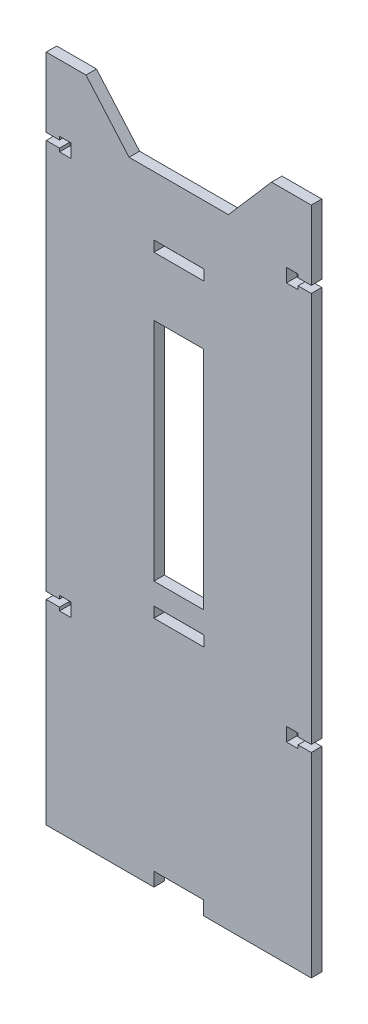
from build123d import *

# Parameters (mm, degrees)
SKETCH1_W                = 80
SKETCH1_H                = 385
BOSS_EXTRUDE1_DEPTH      = 3.175
CUT_EXTRUDE1_DEPTH       = 3.175
LPATTERN1_COUNT          = 2
LPATTERN1_PITCH          = 60
LPATTERN2_COUNT          = 2
LPATTERN2_PITCH          = 120
LPATTERN3_COUNT          = 2
LPATTERN3_PITCH          = 195
LPATTERN6_COUNT          = 2
LPATTERN6_PITCH          = 315
MIRROR2_COPY_1_DEPTH     = 3.175
MIRROR2_COPY_2_DEPTH     = 3.175
MIRROR2_COPY_3_DEPTH     = 3.175
MIRROR2_COPY_4_DEPTH     = 3.175
SKETCH7_W                = 15
SKETCH7_H                = 4.175
CUT_EXTRUDE2_DEPTH       = 10
SKETCH8_W                = 15
SKETCH8_H                = 3.175
CUT_EXTRUDE3_DEPTH       = 10
SKETCH9_W                = 15.1
SKETCH9_H                = 3.2
CUT_EXTRUDE4_DEPTH       = 349.618818518
SKETCH11_R               = 1.55
CUT_EXTRUDE6_DEPTH       = 349.618818518
CUT_EXTRUDE7_DEPTH       = 10
LPATTERN4_COUNT          = 3
LPATTERN4_PITCH          = 7
MIRROR4_COPY_1_DEPTH     = 10
MIRROR4_COPY_2_DEPTH     = 10
SKETCH14_R               = 1.55
CUT_EXTRUDE9_DEPTH       = 349.618818518
LPATTERN5_COUNT          = 2
LPATTERN5_PITCH          = 135
LPATTERN5_COPY_1_DEPTH   = 10
LPATTERN5_COPY_2_DEPTH   = 10
LPATTERN5_COPY_3_DEPTH   = 10
LPATTERN5_COPY_4_DEPTH   = 10
LPATTERN5_COPY_5_DEPTH   = 10
CUT_EXTRUDE10_DEPTH      = 349.618818518
LPATTERN7_COUNT          = 2
LPATTERN7_PITCH          = 60
CUT_EXTRUDE11_DEPTH      = 349.618818518
CUT_EXTRUDE11_DEPTH_BACK = 349.618818518
SKETCH17_W               = 15
SKETCH17_H               = 70
SKETCH18_W               = 15
SKETCH18_H               = 5
BOSS_EXTRUDE3_DEPTH      = 3.175
SKETCH19_W               = 15.1
SKETCH19_H               = 3.2
CUT_EXTRUDE12_DEPTH      = 349.618818518
CUT_EXTRUDE13_DEPTH      = 349.618818518
CUT_EXTRUDE13_DEPTH_BACK = 349.618818518
SKETCH20_W               = 119.305131634
SKETCH20_H               = 211.592052797
BOSS_EXTRUDE4_DEPTH      = 3.175
CUT_EXTRUDE15_DEPTH      = 0.5


with BuildPart() as part:
    # Sketch1 → Boss-Extrude1 (new body)
    with BuildSketch(Plane.XY):
        with Locations((-10, 152.5)):
            Rectangle(SKETCH1_W, SKETCH1_H)
    extrude(amount=-BOSS_EXTRUDE1_DEPTH)

    # Sketch6 → Cut-Extrude1 (cut)
    with BuildSketch(Plane.XY):
        Polygon((-50, 336.05), (-46, 336.05), (-46, 337.05), (-42.5, 337.05), (-42.5, 332.95), (-46, 332.95), (-46, 333.95), (-50, 333.95), align=None)
    cut_extrude1 = extrude(amount=-CUT_EXTRUDE1_DEPTH, mode=Mode.SUBTRACT)

    # LPattern1: Cut-Extrude1 ×2
    with Locations(*[(0, -i * LPATTERN1_PITCH, 0) for i in range(1, LPATTERN1_COUNT)]):
        add(cut_extrude1, mode=Mode.SUBTRACT)

    # LPattern2: Cut-Extrude1 ×2
    with Locations(*[(0, -i * LPATTERN2_PITCH, 0) for i in range(1, LPATTERN2_COUNT)]):
        add(cut_extrude1, mode=Mode.SUBTRACT)

    # LPattern3: Cut-Extrude1 ×2
    with Locations(*[(0, -i * LPATTERN3_PITCH, 0) for i in range(1, LPATTERN3_COUNT)]):
        add(cut_extrude1, mode=Mode.SUBTRACT)

    # LPattern6: Cut-Extrude1 ×2
    with Locations(*[(0, -i * LPATTERN6_PITCH, 0) for i in range(1, LPATTERN6_COUNT)]):
        add(cut_extrude1, mode=Mode.SUBTRACT)

    # Mirror2: Cut-Extrude1 across plane
    add(cut_extrude1.mirror(Plane.ZY.offset(10)), mode=Mode.SUBTRACT)

    # Mirror2 copy 1 sketch → Mirror2 copy 1 (cut)
    with BuildSketch(Plane(origin=(-20, -60, 0), x_dir=(-1, 0, 0), z_dir=(0, 0, 1))):
        Polygon((-50, -336.05), (-46, -336.05), (-46, -337.05), (-42.5, -337.05), (-42.5, -332.95), (-46, -332.95), (-46, -333.95), (-50, -333.95), align=None)
    extrude(amount=-MIRROR2_COPY_1_DEPTH, mode=Mode.SUBTRACT)

    # Mirror2 copy 2 sketch → Mirror2 copy 2 (cut)
    with BuildSketch(Plane(origin=(-20, -120, 0), x_dir=(-1, 0, 0), z_dir=(0, 0, 1))):
        Polygon((-50, -336.05), (-46, -336.05), (-46, -337.05), (-42.5, -337.05), (-42.5, -332.95), (-46, -332.95), (-46, -333.95), (-50, -333.95), align=None)
    extrude(amount=-MIRROR2_COPY_2_DEPTH, mode=Mode.SUBTRACT)

    # Mirror2 copy 3 sketch → Mirror2 copy 3 (cut)
    with BuildSketch(Plane(origin=(-20, -195, 0), x_dir=(-1, 0, 0), z_dir=(0, 0, 1))):
        Polygon((-50, -336.05), (-46, -336.05), (-46, -337.05), (-42.5, -337.05), (-42.5, -332.95), (-46, -332.95), (-46, -333.95), (-50, -333.95), align=None)
    extrude(amount=-MIRROR2_COPY_3_DEPTH, mode=Mode.SUBTRACT)

    # Mirror2 copy 4 sketch → Mirror2 copy 4 (cut)
    with BuildSketch(Plane(origin=(-20, -315, 0), x_dir=(-1, 0, 0), z_dir=(0, 0, 1))):
        Polygon((-50, -336.05), (-46, -336.05), (-46, -337.05), (-42.5, -337.05), (-42.5, -332.95), (-46, -332.95), (-46, -333.95), (-50, -333.95), align=None)
    extrude(amount=-MIRROR2_COPY_4_DEPTH, mode=Mode.SUBTRACT)

    # Sketch7 → Cut-Extrude2 (cut)
    with BuildSketch(Plane.XY):
        with Locations((-10, 342.9125)):
            Rectangle(SKETCH7_W, SKETCH7_H)
        with Locations((-10, -37.9125)):
            Rectangle(SKETCH7_W, SKETCH7_H)
    extrude(amount=-CUT_EXTRUDE2_DEPTH, mode=Mode.SUBTRACT)

    # Sketch8 → Cut-Extrude3 (cut)
    with BuildSketch(Plane.XY):
        with Locations((-10, 36.5875)):
            Rectangle(SKETCH8_W, SKETCH8_H)
    extrude(amount=-CUT_EXTRUDE3_DEPTH, mode=Mode.SUBTRACT)

    # Sketch9 → Cut-Extrude4 (cut, through all)
    with BuildSketch(Plane.XY):
        with Locations((-9.95, 127.575)):
            Rectangle(SKETCH9_W, SKETCH9_H)
    cut_extrude4 = extrude(amount=-CUT_EXTRUDE4_DEPTH, mode=Mode.SUBTRACT)

    # Sketch11 → Cut-Extrude6 (cut, through all)
    with BuildSketch(Plane.XY):
        with Locations((-34, 325.825)):
            Circle(SKETCH11_R)
        with Locations((-34, 267.825)):
            Circle(SKETCH11_R)
        with Locations((14, 325.825)):
            Circle(SKETCH11_R)
        with Locations((14, 267.825)):
            Circle(SKETCH11_R)
    extrude(amount=-CUT_EXTRUDE6_DEPTH, mode=Mode.SUBTRACT)

    # Sketch12 → Cut-Extrude7 (cut)
    with BuildSketch(Plane.XY):
        with BuildLine():
            Line((-2, 286.825), (-2, 314.825))
            ThreePointArc((-2, 314.825), (0, 316.825), (2, 314.825))
            Line((2, 314.825), (2, 286.825))
            ThreePointArc((2, 286.825), (0, 284.825), (-2, 286.825))
        make_face()
    cut_extrude7 = extrude(amount=-CUT_EXTRUDE7_DEPTH, mode=Mode.SUBTRACT)

    # LPattern4: Cut-Extrude7 ×3
    with Locations(*[(i * LPATTERN4_PITCH, 0, 0) for i in range(1, LPATTERN4_COUNT)]):
        add(cut_extrude7, mode=Mode.SUBTRACT)

    # Mirror4: Cut-Extrude7 across plane
    add(cut_extrude7.mirror(Plane.ZY.offset(10)), mode=Mode.SUBTRACT)

    # Mirror4 copy 1 sketch → Mirror4 copy 1 (cut)
    with BuildSketch(Plane(origin=(-27, 0, 0), x_dir=(-1, 0, 0), z_dir=(0, 0, 1))):
        with BuildLine():
            Line((-2, -286.825), (-2, -314.825))
            ThreePointArc((-2, -314.825), (0, -316.825), (2, -314.825))
            Line((2, -314.825), (2, -286.825))
            ThreePointArc((2, -286.825), (0, -284.825), (-2, -286.825))
        make_face()
    extrude(amount=-MIRROR4_COPY_1_DEPTH, mode=Mode.SUBTRACT)

    # Mirror4 copy 2 sketch → Mirror4 copy 2 (cut)
    with BuildSketch(Plane(origin=(-34, 0, 0), x_dir=(-1, 0, 0), z_dir=(0, 0, 1))):
        with BuildLine():
            Line((-2, -286.825), (-2, -314.825))
            ThreePointArc((-2, -314.825), (0, -316.825), (2, -314.825))
            Line((2, -314.825), (2, -286.825))
            ThreePointArc((2, -286.825), (0, -284.825), (-2, -286.825))
        make_face()
    extrude(amount=-MIRROR4_COPY_2_DEPTH, mode=Mode.SUBTRACT)

    # Sketch14 → Cut-Extrude9 (cut, through all)
    with BuildSketch(Plane.XY):
        with Locations((-10, 327.825)):
            Circle(SKETCH14_R)
    extrude(amount=-CUT_EXTRUDE9_DEPTH, mode=Mode.SUBTRACT)

    # LPattern5: Cut-Extrude7 ×2
    with Locations(*[(0, -i * LPATTERN5_PITCH, 0) for i in range(1, LPATTERN5_COUNT)]):
        add(cut_extrude7, mode=Mode.SUBTRACT)

    # LPattern5 copy 1 sketch → LPattern5 copy 1 (cut)
    with BuildSketch(Plane(origin=(7, -135, 0), x_dir=(1, 0, 0), z_dir=(0, 0, 1))):
        with BuildLine():
            Line((-2, 286.825), (-2, 314.825))
            ThreePointArc((-2, 314.825), (0, 316.825), (2, 314.825))
            Line((2, 314.825), (2, 286.825))
            ThreePointArc((2, 286.825), (0, 284.825), (-2, 286.825))
        make_face()
    extrude(amount=-LPATTERN5_COPY_1_DEPTH, mode=Mode.SUBTRACT)

    # LPattern5 copy 2 sketch → LPattern5 copy 2 (cut)
    with BuildSketch(Plane(origin=(14, -135, 0), x_dir=(1, 0, 0), z_dir=(0, 0, 1))):
        with BuildLine():
            Line((-2, 286.825), (-2, 314.825))
            ThreePointArc((-2, 314.825), (0, 316.825), (2, 314.825))
            Line((2, 314.825), (2, 286.825))
            ThreePointArc((2, 286.825), (0, 284.825), (-2, 286.825))
        make_face()
    extrude(amount=-LPATTERN5_COPY_2_DEPTH, mode=Mode.SUBTRACT)

    # LPattern5 copy 3 sketch → LPattern5 copy 3 (cut)
    with BuildSketch(Plane(origin=(-20, -135, 0), x_dir=(-1, 0, 0), z_dir=(0, 0, 1))):
        with BuildLine():
            Line((-2, -286.825), (-2, -314.825))
            ThreePointArc((-2, -314.825), (0, -316.825), (2, -314.825))
            Line((2, -314.825), (2, -286.825))
            ThreePointArc((2, -286.825), (0, -284.825), (-2, -286.825))
        make_face()
    extrude(amount=-LPATTERN5_COPY_3_DEPTH, mode=Mode.SUBTRACT)

    # LPattern5 copy 4 sketch → LPattern5 copy 4 (cut)
    with BuildSketch(Plane(origin=(-27, -135, 0), x_dir=(-1, 0, 0), z_dir=(0, 0, 1))):
        with BuildLine():
            Line((-2, -286.825), (-2, -314.825))
            ThreePointArc((-2, -314.825), (0, -316.825), (2, -314.825))
            Line((2, -314.825), (2, -286.825))
            ThreePointArc((2, -286.825), (0, -284.825), (-2, -286.825))
        make_face()
    extrude(amount=-LPATTERN5_COPY_4_DEPTH, mode=Mode.SUBTRACT)

    # LPattern5 copy 5 sketch → LPattern5 copy 5 (cut)
    with BuildSketch(Plane(origin=(-34, -135, 0), x_dir=(-1, 0, 0), z_dir=(0, 0, 1))):
        with BuildLine():
            Line((-2, -286.825), (-2, -314.825))
            ThreePointArc((-2, -314.825), (0, -316.825), (2, -314.825))
            Line((2, -314.825), (2, -286.825))
            ThreePointArc((2, -286.825), (0, -284.825), (-2, -286.825))
        make_face()
    extrude(amount=-LPATTERN5_COPY_5_DEPTH, mode=Mode.SUBTRACT)

    # Sketch15 → Cut-Extrude10 (cut, through all)
    with BuildSketch(Plane.XY):
        with BuildLine():
            Line((-38, 240), (18, 240))
            ThreePointArc((18, 240), (20.828427125, 238.828427125), (22, 236))
            Line((22, 236), (22, 229))
            ThreePointArc((22, 229), (20.828427125, 226.171572875), (18, 225))
            Line((18, 225), (-38, 225))
            ThreePointArc((-38, 225), (-40.828427125, 226.171572875), (-42, 229))
            Line((-42, 229), (-42, 236))
            ThreePointArc((-42, 236), (-40.828427125, 238.828427125), (-38, 240))
        make_face()
    extrude(amount=-CUT_EXTRUDE10_DEPTH, mode=Mode.SUBTRACT)

    # LPattern7: Cut-Extrude4 ×2
    with Locations(*[(0, i * LPATTERN7_PITCH, 0) for i in range(1, LPATTERN7_COUNT)]):
        add(cut_extrude4, mode=Mode.SUBTRACT)

    # Sketch17 → Cut-Extrude11 (cut, two sides: drawn at the far end of the back side and taken through both)
    with BuildSketch(Plane.XY.offset(-CUT_EXTRUDE11_DEPTH_BACK)):
        with Locations((-10, 73.175)):
            Rectangle(SKETCH17_W, SKETCH17_H)
    extrude(amount=CUT_EXTRUDE11_DEPTH + CUT_EXTRUDE11_DEPTH_BACK, mode=Mode.SUBTRACT)

    # Sketch18 → Boss-Extrude3 (add)
    with BuildSketch(Plane.XY):
        with Locations((-10, 37.5)):
            Rectangle(SKETCH18_W, SKETCH18_H)
    extrude(amount=-BOSS_EXTRUDE3_DEPTH)

    # Sketch19 → Cut-Extrude12 (cut, through all)
    with BuildSketch(Plane.XY):
        with Locations((-9.95, 31.9)):
            Rectangle(SKETCH19_W, SKETCH19_H)
    extrude(amount=-CUT_EXTRUDE12_DEPTH, mode=Mode.SUBTRACT)

    # Sketch20 → Cut-Extrude13 (cut, two sides: drawn at the far end of the back side and taken through both)
    with BuildSketch(Plane.XY.offset(-CUT_EXTRUDE13_DEPTH_BACK)):
        with Locations((-17.733713621, 252.846026399)):
            Rectangle(SKETCH20_W, SKETCH20_H)
    extrude(amount=CUT_EXTRUDE13_DEPTH + CUT_EXTRUDE13_DEPTH_BACK, mode=Mode.SUBTRACT)

    # Sketch22 → Boss-Extrude4 (add)
    with BuildSketch(Plane.XY):
        Polygon((-50, 147.05), (-50, 162.05), (-38, 162.05), (-25, 147.05), align=None)
    boss_extrude4 = extrude(amount=-BOSS_EXTRUDE4_DEPTH)

    # Mirror5: Boss-Extrude4 across plane
    add(boss_extrude4.mirror(Plane.ZY.offset(10)))

    # Sketch24 → Cut-Extrude15 (cut)
    # profile 1 of 11: a face of its own
    with BuildSketch(Plane(origin=(0, 0, -3.175), x_dir=(-1, 0, 0), z_dir=(0, 0, -1))):
        with BuildLine():
            Line((-18.764957265, 6.143378954), (-17.81517094, 6.143378954))
            Line((-17.81517094, 6.143378954), (-17.81517094, 2.700403527))
            add(Edge.make_bspline(
                [(-17.81517094, 2.700403527), (-17.815119295, 2.664708251), (-17.815019544, 2.595763194), (-17.810025947, 2.496849611), (-17.805456462, 2.405927318), (-17.797211813, 2.323095855), (-17.785031641, 2.24831979), (-17.77323726, 2.181118788), (-17.757274731, 2.122696007), (-17.733285603, 2.056195588), (-17.69632623, 1.981478734), (-17.635936667, 1.903607115), (-17.566252277, 1.832537959), (-17.482731523, 1.773382687), (-17.38886158, 1.725531404), (-17.285158225, 1.690078899), (-17.17176764, 1.670372013), (-17.093364271, 1.667363396), (-17.053009816, 1.665814852)],
                knots=[0, 0, 0, 0, 1.155499968, 2.231836252, 3.205919964, 4.102923608, 4.924856345, 5.658536265, 6.31071849, 6.882491295, 7.94666036, 8.992281882, 10.060072772, 11.158554251, 12.289267114, 13.461410017, 14.693379945, 16, 16, 16, 16], degree=3))
            add(Edge.make_bspline(
                [(-17.053009816, 1.665814852), (-17.010138187, 1.667065877), (-16.926545771, 1.669505164), (-16.806311387, 1.693449408), (-16.694913548, 1.731576846), (-16.594710927, 1.785994416), (-16.505803242, 1.85122341), (-16.430544749, 1.925604905), (-16.371151022, 2.009287253), (-16.332440401, 2.086490592), (-16.310706294, 2.157549543), (-16.294415498, 2.221038019), (-16.282472542, 2.295948136), (-16.2716375, 2.381110011), (-16.265126474, 2.477405757), (-16.258066329, 2.584060952), (-16.25547872, 2.701805359), (-16.255037681, 2.783792999), (-16.254807692, 2.826547023)],
                knots=[0, 0, 0, 0, 1.261321664, 2.459363699, 3.594844139, 4.716940403, 5.803436589, 6.833651888, 7.818396249, 8.814403945, 9.360733334, 10.004355033, 10.743453831, 11.592799886, 12.532235708, 13.585170094, 14.740740724, 16, 16, 16, 16], degree=3))
            Line((-16.254807692, 2.826547023), (-16.254807692, 6.143378954))
            Line((-16.254807692, 6.143378954), (-15.305021368, 6.143378954))
            Line((-15.305021368, 6.143378954), (-15.305021368, 2.98661146))
            add(Edge.make_bspline(
                [(-15.305021368, 2.98661146), (-15.305153263, 2.922655501), (-15.305406884, 2.79967443), (-15.309301744, 2.622941977), (-15.317593197, 2.46152523), (-15.324557061, 2.315377024), (-15.338034522, 2.184694244), (-15.352074875, 2.068918838), (-15.369970513, 1.968461088), (-15.396598147, 1.854102148), (-15.442549559, 1.722422016), (-15.516629259, 1.570798053), (-15.610668644, 1.422349009), (-15.721818498, 1.278707925), (-15.84731685, 1.145269988), (-15.984381133, 1.028128751), (-16.130833737, 0.929039896), (-16.288204985, 0.850426265), (-16.456360948, 0.78911356), (-16.636965403, 0.74791451), (-16.829895192, 0.720079915), (-16.963155444, 0.717406059), (-17.031809228, 0.716028527)],
                knots=[0, 0, 0, 0, 1.170808336, 2.251350247, 3.235597562, 4.129743112, 4.929140599, 5.639994148, 6.264258765, 6.79612947, 7.788252245, 8.809469599, 9.879094798, 10.999557536, 12.129761673, 13.226370002, 14.293821979, 15.358369427, 16.438775801, 17.562147481, 18.744053101, 20, 20, 20, 20], degree=3))
            add(Edge.make_bspline(
                [(-17.031809228, 0.716028527), (-17.077424168, 0.71679685), (-17.167421509, 0.718312737), (-17.299778386, 0.731678895), (-17.427727308, 0.751375585), (-17.55102786, 0.780111029), (-17.670107994, 0.817231855), (-17.784936074, 0.862925007), (-17.89508537, 0.916935613), (-17.999939504, 0.978766894), (-18.099369443, 1.045626781), (-18.190243274, 1.119743779), (-18.27568818, 1.195636658), (-18.353235693, 1.276499312), (-18.423468264, 1.36148282), (-18.486241248, 1.450779783), (-18.541461387, 1.544382271), (-18.590517712, 1.64397746), (-18.632505138, 1.754627417), (-18.667902116, 1.880268006), (-18.698825749, 2.022868516), (-18.721806368, 2.18275022), (-18.742640732, 2.359386165), (-18.755827736, 2.553236515), (-18.762726451, 2.764306831), (-18.764194871, 2.910637506), (-18.764957265, 2.98661146)],
                knots=[0, 0, 0, 0, 1.001158378, 1.975264943, 2.917723546, 3.841610987, 4.75185031, 5.653588123, 6.552117133, 7.442167995, 8.324307438, 9.179605724, 10.014504199, 10.831958861, 11.636465792, 12.43274043, 13.225645099, 14.020104002, 14.867201867, 15.819789774, 16.883317127, 18.068162734, 19.364263498, 20.787406516, 22.332041935, 24, 24, 24, 24], degree=3))
            Line((-18.764957265, 2.98661146), (-18.764957265, 6.143378954))
        make_face()
    # profile 2 of 11: a face of its own
    with BuildSketch(Plane(origin=(0, 0, -3.175), x_dir=(-1, 0, 0), z_dir=(0, 0, -1))):
        Polygon((-14.592681624, 6.143378954), (-13.612154447, 6.143378954), (-12.828792735, 2.765065319), (-11.93094785, 6.143378954), (-11.00766226, 6.143378954), (-10.115117521, 2.765065319), (-9.333875868, 6.143378954), (-8.351228632, 6.143378954), (-9.575562567, 0.851712288), (-10.567750067, 0.851712288), (-11.471955128, 4.272427098), (-12.381460337, 0.851712288), (-13.366227631, 0.851712288), align=None)
    # profile 3 of 11: a face of its own
    with BuildSketch(Plane(origin=(0, 0, -3.175), x_dir=(-1, 0, 0), z_dir=(0, 0, -1))):
        with BuildLine():
            Line((-5.467948718, 0.851712288), (-5.467948718, 6.143378954))
            Line((-5.467948718, 6.143378954), (-4.619925214, 6.143378954))
            add(Edge.make_bspline(
                [(-4.619925214, 6.143378954), (-4.560558266, 6.143385729), (-4.445684348, 6.143398839), (-4.279951263, 6.137578838), (-4.126247823, 6.130050013), (-3.985063172, 6.12162701), (-3.856157005, 6.107112491), (-3.739725344, 6.091815775), (-3.635535557, 6.073368877), (-3.571120673, 6.056821438), (-3.540815304, 6.049036339)],
                knots=[0, 0, 0, 0, 1.311965854, 2.538629056, 3.664479157, 4.713267157, 5.663616078, 6.530575999, 7.308677837, 8, 8, 8, 8], degree=3))
            add(Edge.make_bspline(
                [(-3.540815304, 6.049036339), (-3.501021278, 6.038055319), (-3.422932623, 6.016507031), (-3.31108475, 5.972989333), (-3.20498144, 5.924616326), (-3.104752243, 5.869431772), (-3.011012605, 5.80676944), (-2.924118771, 5.736132021), (-2.842196654, 5.660354899), (-2.768155122, 5.577326187), (-2.701233776, 5.489590973), (-2.643091125, 5.397172245), (-2.592572613, 5.301483147), (-2.552144572, 5.201319494), (-2.521682802, 5.097142567), (-2.49940319, 4.989397219), (-2.484962985, 4.877742515), (-2.483598575, 4.801780171), (-2.482905983, 4.763220701)],
                knots=[0, 0, 0, 0, 1.099996261, 2.158545794, 3.195537121, 4.207578794, 5.205712374, 6.197378256, 7.190519799, 8.17788031, 9.159561366, 10.129234751, 11.085776129, 12.040971148, 13.00380137, 13.975669004, 14.972423361, 16, 16, 16, 16], degree=3))
            add(Edge.make_bspline(
                [(-2.482905983, 4.763220701), (-2.484716906, 4.713681903), (-2.488281485, 4.616170867), (-2.511052258, 4.472944796), (-2.553751007, 4.337575572), (-2.609621281, 4.207568393), (-2.685587386, 4.083408184), (-2.782049648, 3.965153983), (-2.897445693, 3.849164563), (-2.98596083, 3.77963673), (-3.032001202, 3.743472437)],
                knots=[0, 0, 0, 0, 0.986156485, 1.941127874, 2.875419072, 3.804401753, 4.751181392, 5.761612777, 6.835722519, 8, 8, 8, 8], degree=3))
            add(Edge.make_bspline(
                [(-3.032001202, 3.743472437), (-2.994692293, 3.724426563), (-2.921539845, 3.687082872), (-2.81768486, 3.625700993), (-2.72152648, 3.56041358), (-2.632633561, 3.492534241), (-2.552870733, 3.419185474), (-2.478944455, 3.344593735), (-2.414501866, 3.264485227), (-2.356875361, 3.181715171), (-2.306787339, 3.095085045), (-2.263166196, 3.00474115), (-2.226320981, 2.910374851), (-2.195119499, 2.812466396), (-2.171849426, 2.710679024), (-2.156676844, 2.604976334), (-2.145059766, 2.495718825), (-2.144156067, 2.421295338), (-2.143696581, 2.383454742)],
                knots=[0, 0, 0, 0, 1.164658916, 2.283573913, 3.35186032, 4.395461096, 5.390182219, 6.362969632, 7.312859996, 8.245001507, 9.165155236, 10.092416118, 11.032087915, 11.979892451, 12.947605196, 13.931445124, 14.948243989, 16, 16, 16, 16], degree=3))
            add(Edge.make_bspline(
                [(-2.143696581, 2.383454742), (-2.146678336, 2.311181367), (-2.152562817, 2.168550151), (-2.195587274, 1.959134769), (-2.27017801, 1.760589993), (-2.370337988, 1.573704925), (-2.493754352, 1.40388958), (-2.635647779, 1.255132812), (-2.794589727, 1.129213511), (-2.941232885, 1.044227751), (-3.068067668, 0.987194359), (-3.173122549, 0.951932719), (-3.285949265, 0.91926639), (-3.40861453, 0.896327419), (-3.538894589, 0.87533115), (-3.678059682, 0.862367618), (-3.825849712, 0.853582553), (-3.927358293, 0.852348313), (-3.979667468, 0.851712288)],
                knots=[0, 0, 0, 0, 1.284142165, 2.534249414, 3.780121997, 5.041676246, 6.291546858, 7.49970053, 8.684500223, 9.883330709, 10.50184324, 11.153274765, 11.851151195, 12.587658647, 13.369265475, 14.195992086, 15.070362669, 16, 16, 16, 16], degree=3))
            Line((-3.979667468, 0.851712288), (-5.467948718, 0.851712288))
        make_face()
        with BuildLine():
            Line((-4.518162393, 5.193592629), (-4.518162393, 4.040280664))
            Line((-4.518162393, 4.040280664), (-4.265875401, 4.040280664))
            add(Edge.make_bspline(
                [(-4.265875401, 4.040280664), (-4.231587332, 4.040579669), (-4.16539629, 4.04115688), (-4.06979035, 4.048591156), (-3.980892267, 4.061274493), (-3.89903921, 4.078970939), (-3.823468689, 4.101442846), (-3.75466347, 4.128481388), (-3.692926077, 4.16147135), (-3.621201506, 4.210611353), (-3.545383462, 4.282923067), (-3.47864169, 4.387392322), (-3.439331232, 4.507531566), (-3.434953108, 4.592263064), (-3.432692308, 4.636017175)],
                knots=[0, 0, 0, 0, 1.065314748, 2.056525647, 2.977365736, 3.853934255, 4.656397591, 5.425096493, 6.14721249, 6.826394842, 8.123232004, 9.372140726, 10.643011755, 12, 12, 12, 12], degree=3))
            add(Edge.make_bspline(
                [(-3.432692308, 4.636017175), (-3.434501361, 4.67700017), (-3.437999094, 4.756239143), (-3.477579671, 4.867497719), (-3.539056132, 4.966095587), (-3.611637734, 5.033577765), (-3.679987417, 5.079666103), (-3.738512609, 5.110013311), (-3.802748403, 5.137179821), (-3.873938334, 5.157951997), (-3.951675868, 5.173538706), (-4.035583391, 5.184985277), (-4.125805672, 5.192776301), (-4.188122394, 5.193314683), (-4.220294137, 5.193592629)],
                knots=[0, 0, 0, 0, 1.347982417, 2.606269829, 3.849316587, 5.153353503, 5.842674298, 6.568177932, 7.326619318, 8.142485038, 9.012069166, 9.942760135, 10.937925643, 12, 12, 12, 12], degree=3))
            Line((-4.220294137, 5.193592629), (-4.518162393, 5.193592629))
        make_face(mode=Mode.SUBTRACT)
        with BuildLine():
            Line((-4.518162393, 3.158336219), (-4.518162393, 1.801498612))
            Line((-4.518162393, 1.801498612), (-4.244674813, 1.801498612))
            add(Edge.make_bspline(
                [(-4.244674813, 1.801498612), (-4.19060597, 1.801807506), (-4.086651873, 1.802401392), (-3.937737813, 1.809576945), (-3.802337704, 1.822509617), (-3.680810305, 1.838655016), (-3.572969474, 1.860529506), (-3.479179738, 1.888340116), (-3.398154894, 1.918936632), (-3.33038077, 1.956726961), (-3.275013193, 2.000705533), (-3.22504976, 2.045652691), (-3.18431269, 2.097503483), (-3.15208076, 2.154032099), (-3.124184081, 2.213834329), (-3.107358775, 2.279245426), (-3.094548577, 2.348326763), (-3.093843598, 2.396108831), (-3.093482906, 2.42055577)],
                knots=[0, 0, 0, 0, 1.753078804, 3.370512758, 4.83203934, 6.162291463, 7.344201807, 8.395507345, 9.331626367, 10.147333109, 10.898971645, 11.62040215, 12.321813352, 13.025280112, 13.727906689, 14.453419512, 15.208716525, 16, 16, 16, 16], degree=3))
            add(Edge.make_bspline(
                [(-3.093482906, 2.42055577), (-3.094278335, 2.448511231), (-3.095827615, 2.502960947), (-3.10848061, 2.582545018), (-3.131475235, 2.656842029), (-3.160438087, 2.727751854), (-3.200741435, 2.792735675), (-3.248640586, 2.854042335), (-3.306514989, 2.909595802), (-3.371598131, 2.962756157), (-3.447511173, 3.009300928), (-3.53428973, 3.049686761), (-3.632405232, 3.083415522), (-3.7421616, 3.110270383), (-3.863077673, 3.133061733), (-3.996036004, 3.146670684), (-4.13992927, 3.15679226), (-4.239707203, 3.157809872), (-4.291316106, 3.158336219)],
                knots=[0, 0, 0, 0, 0.845221588, 1.646264278, 2.427170338, 3.19324141, 3.95557735, 4.731569926, 5.540061037, 6.376114724, 7.268642756, 8.224665384, 9.265483498, 10.400594375, 11.639216012, 12.983232105, 14.439614077, 16, 16, 16, 16], degree=3))
            Line((-4.291316106, 3.158336219), (-4.518162393, 3.158336219))
        make_face(mode=Mode.SUBTRACT)
    # profile 4 of 11: a face of its own
    with BuildSketch(Plane(origin=(0, 0, -3.175), x_dir=(-1, 0, 0), z_dir=(0, 0, -1))):
        Polygon((0.435354901, 6.143378954), (1.316239316, 6.143378954), (3.453258547, 0.851712288), (2.43881043, 0.851712288), (2.02751903, 1.937182373), (-0.278044872, 1.937182373), (-0.689336271, 0.851712288), (-1.702724359, 0.851712288), align=None)
        Polygon((0.875267094, 4.723999614), (0.082365118, 2.886968698), (1.668169071, 2.886968698), align=None, mode=Mode.SUBTRACT)
    # profile 5 of 11: a face of its own
    with BuildSketch(Plane(origin=(0, 0, -3.175), x_dir=(-1, 0, 0), z_dir=(0, 0, -1))):
        with BuildLine():
            Line((4.233440171, 6.143378954), (5.430213341, 6.143378954))
            add(Edge.make_bspline(
                [(5.430213341, 6.143378954), (5.523515575, 6.14272674), (5.703869848, 6.141466002), (5.96516751, 6.127260515), (6.208141085, 6.105413486), (6.432947198, 6.075358937), (6.639124961, 6.035588539), (6.826408511, 5.98570437), (6.995426417, 5.928121395), (7.148031926, 5.860363341), (7.287346078, 5.781364178), (7.419629311, 5.693365454), (7.544621891, 5.593143517), (7.66407789, 5.482631848), (7.776455704, 5.359808671), (7.883626826, 5.226708382), (7.982967221, 5.081400842), (8.077479733, 4.92737007), (8.162953725, 4.763963297), (8.237507334, 4.592571407), (8.299961344, 4.414297372), (8.350708461, 4.228951197), (8.391159771, 4.037148175), (8.419462737, 3.838501266), (8.436959912, 3.633194384), (8.438734854, 3.49404783), (8.439636752, 3.423343564)],
                knots=[0, 0, 0, 0, 1.44355588, 2.790409838, 4.047694926, 5.217575253, 6.298404546, 7.294384826, 8.214239204, 9.058592145, 9.873746385, 10.689560431, 11.514393297, 12.350027578, 13.205127629, 14.088021785, 14.991911688, 15.926770944, 16.882954281, 17.842803888, 18.816321264, 19.80318086, 20.814351908, 21.847355356, 22.906180909, 24, 24, 24, 24], degree=3))
            add(Edge.make_bspline(
                [(8.439636752, 3.423343564), (8.437275097, 3.323575244), (8.43262604, 3.127175465), (8.393464979, 2.838961052), (8.330128285, 2.562678791), (8.241071141, 2.300489869), (8.130664121, 2.054729117), (7.998770574, 1.829730423), (7.847324364, 1.626701466), (7.678089849, 1.446653163), (7.494850087, 1.291899207), (7.304427024, 1.159363769), (7.104965592, 1.054848516), (6.929212194, 0.988570217), (6.776812072, 0.947350849), (6.643006414, 0.922989806), (6.491016839, 0.90064926), (6.319426176, 0.883384966), (6.128987156, 0.867989459), (5.918940688, 0.85962414), (5.689966841, 0.852673801), (5.530922854, 0.85204119), (5.448233841, 0.851712288)],
                knots=[0, 0, 0, 0, 1.315458931, 2.589557908, 3.828601765, 5.048913369, 6.235739168, 7.376350998, 8.481830359, 9.569842114, 10.627874879, 11.640079404, 12.624025415, 13.590060155, 14.111227486, 14.704434459, 15.382649715, 16.137166398, 16.978595427, 17.902333227, 18.909396075, 20, 20, 20, 20], degree=3))
            Line((5.448233841, 0.851712288), (4.233440171, 0.851712288))
            Line((4.233440171, 0.851712288), (4.233440171, 6.143378954))
        make_face()
        with BuildLine():
            Line((5.183226496, 5.193592629), (5.183226496, 1.801498612))
            Line((5.183226496, 1.801498612), (5.679320246, 1.801498612))
            add(Edge.make_bspline(
                [(5.679320246, 1.801498612), (5.738347783, 1.801606775), (5.851877388, 1.801814808), (6.015788439, 1.811723611), (6.1673646, 1.821669317), (6.306188617, 1.840546598), (6.43327081, 1.861574562), (6.5468654, 1.890837852), (6.649314067, 1.921576459), (6.739365419, 1.960710516), (6.82184512, 2.004758502), (6.898211902, 2.056365824), (6.971927228, 2.113673808), (7.04161293, 2.178367965), (7.107532752, 2.249591621), (7.16929667, 2.327711762), (7.227729069, 2.412490039), (7.281330101, 2.504374697), (7.330311011, 2.602395413), (7.373762567, 2.705602714), (7.409790318, 2.814856093), (7.439734379, 2.929132809), (7.461132806, 3.049427768), (7.478835923, 3.174849965), (7.487962396, 3.30589631), (7.489214947, 3.395064622), (7.489850427, 3.440304034)],
                knots=[0, 0, 0, 0, 1.50275155, 2.890291501, 4.180787663, 5.369391935, 6.45668281, 7.458360028, 8.354766181, 9.177074746, 9.954075863, 10.732690366, 11.5210699, 12.329727389, 13.151100085, 13.990027547, 14.863562427, 15.770965086, 16.696477834, 17.652329173, 18.619756807, 19.62365428, 20.657822005, 21.729286259, 22.847956731, 24, 24, 24, 24], degree=3))
            add(Edge.make_bspline(
                [(7.489850427, 3.440304034), (7.488584767, 3.509629157), (7.486116826, 3.644807773), (7.462316544, 3.84169838), (7.423574224, 4.027100381), (7.368292667, 4.2003257), (7.29860855, 4.361861193), (7.211382635, 4.51033831), (7.110368788, 4.648251263), (7.030489793, 4.729155426), (6.990576589, 4.769580877)],
                knots=[0, 0, 0, 0, 1.13821349, 2.219428113, 3.251817212, 4.244760574, 5.201143372, 6.134805572, 7.068016741, 8, 8, 8, 8], degree=3))
            add(Edge.make_bspline(
                [(6.990576589, 4.769580877), (6.951218391, 4.804028827), (6.870833727, 4.874384862), (6.729704674, 4.958689385), (6.574187767, 5.032759172), (6.400725244, 5.091488253), (6.210993546, 5.137933713), (6.003862624, 5.169966012), (5.780441712, 5.190549627), (5.625660909, 5.192556564), (5.545756544, 5.193592629)],
                knots=[0, 0, 0, 0, 0.813307809, 1.661089106, 2.549956539, 3.493439533, 4.508053171, 5.589449661, 6.755572447, 8, 8, 8, 8], degree=3))
            Line((5.545756544, 5.193592629), (5.183226496, 5.193592629))
        make_face(mode=Mode.SUBTRACT)
    # profile 6 of 11: a face of its own
    with BuildSketch(Plane(origin=(0, 0, -3.175), x_dir=(-1, 0, 0), z_dir=(0, 0, -1))):
        with BuildLine():
            Line((14.239057492, 5.301715626), (13.520357572, 4.613756558))
            add(Edge.make_bspline(
                [(13.520357572, 4.613756558), (13.463456845, 4.670725462), (13.351808226, 4.782507857), (13.169220874, 4.928000326), (12.980115792, 5.051697686), (12.783870559, 5.153410309), (12.580211803, 5.232307462), (12.36954143, 5.28874512), (12.151516707, 5.322219252), (12.003923702, 5.326905516), (11.929253472, 5.32927639)],
                knots=[0, 0, 0, 0, 1.075575784, 2.110457258, 3.113929901, 4.09197124, 5.059417775, 6.02750972, 7.002078037, 8, 8, 8, 8], degree=3))
            add(Edge.make_bspline(
                [(11.929253472, 5.32927639), (11.864516666, 5.327615129), (11.737400273, 5.324353098), (11.550614976, 5.299581457), (11.372130183, 5.258201544), (11.201102658, 5.200876585), (11.038576583, 5.126278694), (10.883610253, 5.035559204), (10.737157331, 4.928024102), (10.600371028, 4.805711879), (10.47582666, 4.672171628), (10.36709285, 4.529236338), (10.274475003, 4.379570203), (10.198231626, 4.222407508), (10.140218708, 4.057989467), (10.098805075, 3.886435438), (10.072517717, 3.708243983), (10.069413965, 3.586679926), (10.06784188, 3.525106385)],
                knots=[0, 0, 0, 0, 1.075001177, 2.110859044, 3.123021556, 4.114053297, 5.101481495, 6.087880186, 7.091499647, 8.114004866, 9.131394192, 10.11971144, 11.092043119, 12.050101265, 13.015322563, 13.981809771, 14.977764287, 16, 16, 16, 16], degree=3))
            add(Edge.make_bspline(
                [(10.06784188, 3.525106385), (10.069308246, 3.4614017), (10.072197186, 3.335894751), (10.099948726, 3.151707907), (10.14270475, 2.974506891), (10.205288171, 2.805606493), (10.282309407, 2.642693014), (10.379985025, 2.488922241), (10.49388457, 2.341945928), (10.62380452, 2.204323017), (10.765123874, 2.077467813), (10.918177332, 1.968039249), (11.07830807, 1.873626019), (11.248100605, 1.798853792), (11.424607842, 1.738819886), (11.60962007, 1.69649083), (11.802720688, 1.670522101), (11.934471498, 1.667399554), (12.00133547, 1.665814852)],
                knots=[0, 0, 0, 0, 1.022067601, 2.013613092, 2.983553406, 3.943623673, 4.90013463, 5.87121881, 6.861774014, 7.881098904, 8.905697761, 9.905387765, 10.89678721, 11.884561068, 12.87834324, 13.885584958, 14.926927371, 16, 16, 16, 16], degree=3))
            add(Edge.make_bspline(
                [(12.00133547, 1.665814852), (12.044828008, 1.666207277), (12.130213537, 1.666977696), (12.255459557, 1.679483761), (12.375415161, 1.697362634), (12.490544905, 1.721032139), (12.599686287, 1.754528736), (12.704350443, 1.793698882), (12.803924135, 1.839927464), (12.897867483, 1.894809454), (12.987578639, 1.956325457), (13.072217886, 2.026712846), (13.153269899, 2.104384644), (13.229787594, 2.190289722), (13.300475887, 2.285196173), (13.367599451, 2.387359965), (13.430389734, 2.497795011), (13.467490856, 2.575778647), (13.486436632, 2.615601176)],
                knots=[0, 0, 0, 0, 1.109579412, 2.178351274, 3.208885622, 4.204702371, 5.174744997, 6.119429583, 7.05542196, 7.97267548, 8.893247984, 9.828544973, 10.778894627, 11.756245826, 12.760884819, 13.796418446, 14.874735809, 16, 16, 16, 16], degree=3))
            Line((13.486436632, 2.615601176), (11.96741453, 2.615601176))
            Line((11.96741453, 2.615601176), (11.96741453, 3.565387501))
            Line((11.96741453, 3.565387501), (14.605827658, 3.565387501))
            Line((14.605827658, 3.565387501), (14.613247863, 3.339601243))
            add(Edge.make_bspline(
                [(14.613247863, 3.339601243), (14.612294422, 3.281613603), (14.610389241, 3.165741808), (14.592977886, 2.993228443), (14.564136241, 2.823003111), (14.524706951, 2.65523678), (14.475292077, 2.489106498), (14.412272645, 2.3262031), (14.338477274, 2.165421829), (14.255794797, 2.007445881), (14.162883482, 1.855863663), (14.062850809, 1.712335314), (13.957122812, 1.577109248), (13.843399951, 1.452069504), (13.723453077, 1.336165694), (13.597046074, 1.229843712), (13.463731847, 1.133013598), (13.324216615, 1.044857357), (13.177705703, 0.967593614), (13.025004629, 0.900384407), (12.866343951, 0.843305047), (12.701314043, 0.796512389), (12.530239644, 0.76040813), (12.353117088, 0.735651393), (12.169849098, 0.718828912), (12.045542297, 0.716973274), (11.982254941, 0.716028527)],
                knots=[0, 0, 0, 0, 1.006889344, 2.011981806, 3.007738725, 4.003571281, 5.003404394, 6.015442001, 7.03424805, 8.074616296, 9.110249922, 10.119753985, 11.111721717, 12.089233633, 13.052717867, 14.006597561, 14.955430184, 15.912305663, 16.870361111, 17.829300583, 18.807640451, 19.796414044, 20.806216501, 21.841577364, 22.90109906, 24, 24, 24, 24], degree=3))
            add(Edge.make_bspline(
                [(11.982254941, 0.716028527), (11.914731624, 0.716961482), (11.780880269, 0.718810876), (11.582963102, 0.736131717), (11.390787635, 0.764718646), (11.204305935, 0.804281978), (11.023085029, 0.853521706), (10.847436283, 0.915329212), (10.677718945, 0.988851194), (10.513424793, 1.072140764), (10.356653684, 1.16659839), (10.207756967, 1.270567749), (10.067547349, 1.384717626), (9.93458865, 1.507137129), (9.811987297, 1.64083534), (9.695174417, 1.781478452), (9.589809196, 1.934224693), (9.491361241, 2.094121985), (9.403899291, 2.261103323), (9.327412558, 2.4320803), (9.262184716, 2.60606296), (9.210750986, 2.783861424), (9.168991614, 2.964235931), (9.139112, 3.14797089), (9.122237585, 3.3350433), (9.119455754, 3.46076565), (9.118055556, 3.524046355)],
                knots=[0, 0, 0, 0, 1.084149091, 2.14910686, 3.187506334, 4.202448172, 5.208724393, 6.201130722, 7.189831603, 8.176984443, 9.156919086, 10.126598231, 11.090766514, 12.05840148, 13.026036446, 14.001772938, 14.991905635, 16.003017641, 17.015720547, 18.016462227, 19.009322657, 19.99686681, 20.986544154, 21.980959929, 22.983742515, 24, 24, 24, 24], degree=3))
            add(Edge.make_bspline(
                [(9.118055556, 3.524046355), (9.11993072, 3.61037476), (9.123633615, 3.780847764), (9.157928037, 4.031955581), (9.211387933, 4.274877338), (9.288108265, 4.508728332), (9.386558568, 4.733830693), (9.505344205, 4.950712862), (9.647045457, 5.159144311), (9.756731958, 5.288192326), (9.8123748, 5.353657066)],
                knots=[0, 0, 0, 0, 1.034044851, 2.041932006, 3.031217818, 4.011390712, 4.986069675, 5.97149666, 6.970960976, 8, 8, 8, 8], degree=3))
            add(Edge.make_bspline(
                [(9.8123748, 5.353657066), (9.846922896, 5.391530402), (9.915500349, 5.466708405), (10.025121282, 5.571169769), (10.137522232, 5.669367317), (10.254259971, 5.759218829), (10.37472083, 5.8426912), (10.499251517, 5.918219673), (10.627198772, 5.988209115), (10.759560429, 6.049085598), (10.895643556, 6.103666444), (11.036050845, 6.149849514), (11.179730673, 6.190756737), (11.32795533, 6.221876642), (11.479227393, 6.247790924), (11.634620643, 6.265160033), (11.793711623, 6.277890353), (11.90131276, 6.278668837), (11.955754207, 6.279062715)],
                knots=[0, 0, 0, 0, 1.020590567, 2.025856924, 3.013483481, 3.991664875, 4.957826714, 5.930500614, 6.890802512, 7.860442893, 8.829981142, 9.809047939, 10.802672283, 11.803273349, 12.823572789, 13.857849586, 14.916166035, 16, 16, 16, 16], degree=3))
            add(Edge.make_bspline(
                [(11.955754207, 6.279062715), (12.012663194, 6.27818508), (12.125891181, 6.27643891), (12.294242448, 6.264356551), (12.460254361, 6.245716319), (12.62322733, 6.217754906), (12.783708292, 6.183272665), (12.940866561, 6.139092378), (13.095727399, 6.088895615), (13.196541218, 6.048875047), (13.246869992, 6.028895781)],
                knots=[0, 0, 0, 0, 1.03180557, 2.052914215, 3.058998889, 4.059601663, 5.049854447, 6.033765722, 7.018406786, 8, 8, 8, 8], degree=3))
            add(Edge.make_bspline(
                [(13.246869992, 6.028895781), (13.28921543, 6.010431343), (13.375344878, 5.972875186), (13.500652611, 5.904164437), (13.626266504, 5.827990685), (13.750831121, 5.741568841), (13.87415666, 5.645060555), (13.99753077, 5.539990158), (14.119694004, 5.425132469), (14.198754382, 5.343387352), (14.239057492, 5.301715626)],
                knots=[0, 0, 0, 0, 0.894392155, 1.819168899, 2.76525314, 3.739198753, 4.75366411, 5.797420238, 6.877176959, 8, 8, 8, 8], degree=3))
        make_face()
    # profile 7 of 11: a face of its own
    with BuildSketch(Plane(origin=(0, 0, -3.175), x_dir=(-1, 0, 0), z_dir=(0, 0, -1))):
        Polygon((15.563034188, 6.143378954), (18.412393162, 6.143378954), (18.412393162, 5.193592629), (16.512820513, 5.193592629), (16.512820513, 4.175964424), (18.412393162, 4.175964424), (18.412393162, 3.2261781), (16.512820513, 3.2261781), (16.512820513, 1.801498612), (18.412393162, 1.801498612), (18.412393162, 0.851712288), (15.563034188, 0.851712288), align=None)
    # profile 8 of 11: a face of its own
    with BuildSketch(Plane(origin=(0, 0, -3.175), x_dir=(-1, 0, 0), z_dir=(0, 0, -1))):
        with BuildLine():
            Line((19.362179487, 6.143378954), (20.46885016, 6.143378954))
            add(Edge.make_bspline(
                [(20.46885016, 6.143378954), (20.542000755, 6.143119312), (20.682689954, 6.142619946), (20.885556094, 6.134741274), (21.071916543, 6.123777457), (21.242047223, 6.10704638), (21.395875351, 6.084862994), (21.533555097, 6.058712453), (21.655082437, 6.028908305), (21.761482288, 5.991769985), (21.857502891, 5.949878524), (21.947007443, 5.901744466), (22.031970547, 5.847903801), (22.111824316, 5.786939834), (22.187262699, 5.719949292), (22.258428014, 5.646864742), (22.324314629, 5.567066458), (22.384514572, 5.481058664), (22.439381975, 5.390580437), (22.487873251, 5.29550755), (22.527306437, 5.195773885), (22.562149884, 5.092820811), (22.587246491, 4.985176592), (22.604700813, 4.873889163), (22.617480185, 4.758566781), (22.618214938, 4.680221875), (22.618589744, 4.640257293)],
                knots=[0, 0, 0, 0, 1.749336639, 3.364467119, 4.854658419, 6.213483162, 7.451590619, 8.570285859, 9.5643256, 10.440900261, 11.26203566, 12.067320669, 12.869050712, 13.665104639, 14.467235401, 15.27997916, 16.102287765, 16.939272006, 17.78853747, 18.631303466, 19.488103222, 20.351255419, 21.228522269, 22.127379805, 23.044756219, 24, 24, 24, 24], degree=3))
            add(Edge.make_bspline(
                [(22.618589744, 4.640257293), (22.617616134, 4.59854345), (22.615707063, 4.516750205), (22.60542377, 4.396602601), (22.586629139, 4.281653777), (22.558161937, 4.172240289), (22.525442586, 4.06700036), (22.481934242, 3.967875731), (22.432830775, 3.873424779), (22.374512023, 3.784983547), (22.310510041, 3.70058758), (22.236077082, 3.623470401), (22.156035259, 3.549487251), (22.06588513, 3.483272187), (21.969600595, 3.420347982), (21.865268582, 3.363321896), (21.753569999, 3.310760423), (21.675040363, 3.281448515), (21.634882479, 3.266459216)],
                knots=[0, 0, 0, 0, 1.099860209, 2.156625411, 3.176576793, 4.16617041, 5.135385252, 6.078461593, 7.016046972, 7.938469504, 8.868247731, 9.803980173, 10.76021508, 11.73834243, 12.748633912, 13.790971185, 14.870363756, 16, 16, 16, 16], degree=3))
            Line((21.634882479, 3.266459216), (22.856036325, 0.851712288))
            Line((22.856036325, 0.851712288), (21.800247062, 0.851712288))
            Line((21.800247062, 0.851712288), (20.634214744, 3.158336219))
            Line((20.634214744, 3.158336219), (20.311965812, 3.158336219))
            Line((20.311965812, 3.158336219), (20.311965812, 0.851712288))
            Line((20.311965812, 0.851712288), (19.362179487, 0.851712288))
            Line((19.362179487, 0.851712288), (19.362179487, 6.143378954))
        make_face()
        with BuildLine():
            Line((20.311965812, 4.108122544), (20.681916066, 4.108122544))
            add(Edge.make_bspline(
                [(20.681916066, 4.108122544), (20.727145559, 4.108631949), (20.813750321, 4.10960735), (20.938299344, 4.114131664), (21.051419559, 4.125033026), (21.153596745, 4.138806489), (21.245345046, 4.154709942), (21.325846101, 4.177500555), (21.396340308, 4.201921274), (21.455992307, 4.232269892), (21.506957605, 4.266782854), (21.550962878, 4.305990436), (21.587361548, 4.35136822), (21.61731951, 4.401683034), (21.640623548, 4.457379899), (21.65763371, 4.51784739), (21.667139875, 4.58377431), (21.668233591, 4.629272862), (21.668803419, 4.652977645)],
                knots=[0, 0, 0, 0, 1.688639943, 3.233382647, 4.650958383, 5.928841754, 7.082724185, 8.122798841, 9.049171256, 9.863274652, 10.613301712, 11.341792392, 12.054588806, 12.776240173, 13.521029143, 14.301969904, 15.115324896, 16, 16, 16, 16], degree=3))
            add(Edge.make_bspline(
                [(21.668803419, 4.652977645), (21.667726108, 4.681022135), (21.665609931, 4.736110338), (21.644610878, 4.815418033), (21.611184921, 4.888822731), (21.56536709, 4.955992772), (21.507665488, 5.014878666), (21.441448348, 5.066787051), (21.365286543, 5.107832317), (21.294766443, 5.134905338), (21.230609635, 5.151103406), (21.17271014, 5.163174063), (21.105662176, 5.171728884), (21.029415127, 5.180802794), (20.944163347, 5.186686766), (20.849442163, 5.190980892), (20.745523616, 5.19273783), (20.673082518, 5.193299492), (20.635274773, 5.193592629)],
                knots=[0, 0, 0, 0, 1.020303359, 2.004196876, 2.966617323, 3.9489082, 4.950758222, 5.960522915, 7.003732012, 8.091992268, 8.70421221, 9.413913587, 10.24622431, 11.166358409, 12.212345909, 13.359657661, 14.621978493, 16, 16, 16, 16], degree=3))
            Line((20.635274773, 5.193592629), (20.311965812, 5.193592629))
            Line((20.311965812, 5.193592629), (20.311965812, 4.108122544))
        make_face(mode=Mode.SUBTRACT)
    # profile 9 of 11: a face of its own
    with BuildSketch(Plane(origin=(0, 0, -3.175), x_dir=(-1, 0, 0), z_dir=(0, 0, -1))):
        Polygon((25.671474359, 6.143378954), (26.621260684, 6.143378954), (26.621260684, 1.801498612), (28.113782051, 1.801498612), (28.113782051, 0.851712288), (25.671474359, 0.851712288), align=None)
    # profile 10 of 11: a face of its own
    with BuildSketch(Plane(origin=(0, 0, -3.175), x_dir=(-1, 0, 0), z_dir=(0, 0, -1))):
        Polygon((30.557149773, 6.143378954), (31.438034188, 6.143378954), (33.575053419, 0.851712288), (32.560605302, 0.851712288), (32.149313902, 1.937182373), (29.84375, 1.937182373), (29.4324586, 0.851712288), (28.419070513, 0.851712288), align=None)
        Polygon((30.997061966, 4.723999614), (30.204159989, 2.886968698), (31.789963942, 2.886968698), align=None, mode=Mode.SUBTRACT)
    # profile 11 of 11: a face of its own
    with BuildSketch(Plane(origin=(0, 0, -3.175), x_dir=(-1, 0, 0), z_dir=(0, 0, -1))):
        with BuildLine():
            Line((34.355235043, 0.851712288), (34.355235043, 6.143378954))
            Line((34.355235043, 6.143378954), (35.203258547, 6.143378954))
            add(Edge.make_bspline(
                [(35.203258547, 6.143378954), (35.262625495, 6.143385729), (35.377499413, 6.143398839), (35.543232498, 6.137578838), (35.696935938, 6.130050013), (35.838120588, 6.12162701), (35.967026756, 6.107112491), (36.083458417, 6.091815775), (36.187648204, 6.073368877), (36.252063087, 6.056821438), (36.282368456, 6.049036339)],
                knots=[0, 0, 0, 0, 1.311965854, 2.538629056, 3.664479157, 4.713267157, 5.663616078, 6.530575999, 7.308677837, 8, 8, 8, 8], degree=3))
            add(Edge.make_bspline(
                [(36.282368456, 6.049036339), (36.322162483, 6.038055319), (36.400251137, 6.016507031), (36.512099011, 5.972989333), (36.618202321, 5.924616326), (36.718431518, 5.869431772), (36.812171155, 5.80676944), (36.89906499, 5.736132021), (36.980987107, 5.660354899), (37.055028639, 5.577326187), (37.121949985, 5.489590973), (37.180092636, 5.397172245), (37.230611147, 5.301483147), (37.271039189, 5.201319494), (37.301500959, 5.097142567), (37.32378057, 4.989397219), (37.338220776, 4.877742515), (37.339585186, 4.801780171), (37.340277778, 4.763220701)],
                knots=[0, 0, 0, 0, 1.099996261, 2.158545794, 3.195537121, 4.207578794, 5.205712374, 6.197378256, 7.190519799, 8.17788031, 9.159561366, 10.129234751, 11.085776129, 12.040971148, 13.00380137, 13.975669004, 14.972423361, 16, 16, 16, 16], degree=3))
            add(Edge.make_bspline(
                [(37.340277778, 4.763220701), (37.338466855, 4.713681903), (37.334902276, 4.616170867), (37.312131502, 4.472944796), (37.269432754, 4.337575572), (37.21356248, 4.207568393), (37.137596375, 4.083408184), (37.041134113, 3.965153983), (36.925738068, 3.849164563), (36.837222931, 3.77963673), (36.791182559, 3.743472437)],
                knots=[0, 0, 0, 0, 0.986156485, 1.941127874, 2.875419072, 3.804401753, 4.751181392, 5.761612777, 6.835722519, 8, 8, 8, 8], degree=3))
            add(Edge.make_bspline(
                [(36.791182559, 3.743472437), (36.828491468, 3.724426563), (36.901643916, 3.687082872), (37.005498901, 3.625700993), (37.101657281, 3.56041358), (37.1905502, 3.492534241), (37.270313028, 3.419185474), (37.344239306, 3.344593735), (37.408681894, 3.264485227), (37.4663084, 3.181715171), (37.516396421, 3.095085045), (37.560017565, 3.00474115), (37.59686278, 2.910374851), (37.628064261, 2.812466396), (37.651334334, 2.710679024), (37.666506917, 2.604976334), (37.678123994, 2.495718825), (37.679027694, 2.421295338), (37.679487179, 2.383454742)],
                knots=[0, 0, 0, 0, 1.164658916, 2.283573913, 3.35186032, 4.395461096, 5.390182219, 6.362969632, 7.312859996, 8.245001507, 9.165155236, 10.092416118, 11.032087915, 11.979892451, 12.947605196, 13.931445124, 14.948243989, 16, 16, 16, 16], degree=3))
            add(Edge.make_bspline(
                [(37.679487179, 2.383454742), (37.676505425, 2.311181367), (37.670620943, 2.168550151), (37.627596487, 1.959134769), (37.55300575, 1.760589993), (37.452845772, 1.573704925), (37.329429408, 1.40388958), (37.187535982, 1.255132812), (37.028594033, 1.129213511), (36.881950876, 1.044227751), (36.755116092, 0.987194359), (36.650061211, 0.951932719), (36.537234496, 0.91926639), (36.414569231, 0.896327419), (36.284289172, 0.87533115), (36.145124079, 0.862367618), (35.997334049, 0.853582553), (35.895825468, 0.852348313), (35.843516293, 0.851712288)],
                knots=[0, 0, 0, 0, 1.284142165, 2.534249414, 3.780121997, 5.041676246, 6.291546858, 7.49970053, 8.684500223, 9.883330709, 10.50184324, 11.153274765, 11.851151195, 12.587658647, 13.369265475, 14.195992086, 15.070362669, 16, 16, 16, 16], degree=3))
            Line((35.843516293, 0.851712288), (34.355235043, 0.851712288))
        make_face()
        with BuildLine():
            Line((35.305021368, 5.193592629), (35.305021368, 4.040280664))
            Line((35.305021368, 4.040280664), (35.55730836, 4.040280664))
            add(Edge.make_bspline(
                [(35.55730836, 4.040280664), (35.591596429, 4.040579669), (35.657787471, 4.04115688), (35.75339341, 4.048591156), (35.842291494, 4.061274493), (35.924144551, 4.078970939), (35.999715072, 4.101442846), (36.068520291, 4.128481388), (36.130257684, 4.16147135), (36.201982255, 4.210611353), (36.277800299, 4.282923067), (36.344542071, 4.387392322), (36.383852528, 4.507531566), (36.388230653, 4.592263064), (36.390491453, 4.636017175)],
                knots=[0, 0, 0, 0, 1.065314748, 2.056525647, 2.977365736, 3.853934255, 4.656397591, 5.425096493, 6.14721249, 6.826394842, 8.123232004, 9.372140726, 10.643011755, 12, 12, 12, 12], degree=3))
            add(Edge.make_bspline(
                [(36.390491453, 4.636017175), (36.388682399, 4.67700017), (36.385184667, 4.756239143), (36.34560409, 4.867497719), (36.284127629, 4.966095587), (36.211546027, 5.033577765), (36.143196344, 5.079666103), (36.084671151, 5.110013311), (36.020435358, 5.137179821), (35.949245427, 5.157951997), (35.871507893, 5.173538706), (35.78760037, 5.184985277), (35.697378088, 5.192776301), (35.635061366, 5.193314683), (35.602889623, 5.193592629)],
                knots=[0, 0, 0, 0, 1.347982417, 2.606269829, 3.849316587, 5.153353503, 5.842674298, 6.568177932, 7.326619318, 8.142485038, 9.012069166, 9.942760135, 10.937925643, 12, 12, 12, 12], degree=3))
            Line((35.602889623, 5.193592629), (35.305021368, 5.193592629))
        make_face(mode=Mode.SUBTRACT)
        with BuildLine():
            Line((35.305021368, 3.158336219), (35.305021368, 1.801498612))
            Line((35.305021368, 1.801498612), (35.578508948, 1.801498612))
            add(Edge.make_bspline(
                [(35.578508948, 1.801498612), (35.63257779, 1.801807506), (35.736531888, 1.802401392), (35.885445948, 1.809576945), (36.020846057, 1.822509617), (36.142373456, 1.838655016), (36.250214287, 1.860529506), (36.344004022, 1.888340116), (36.425028867, 1.918936632), (36.492802991, 1.956726961), (36.548170568, 2.000705533), (36.598134001, 2.045652691), (36.638871071, 2.097503483), (36.671103001, 2.154032099), (36.698999679, 2.213834329), (36.715824986, 2.279245426), (36.728635184, 2.348326763), (36.729340163, 2.396108831), (36.729700855, 2.42055577)],
                knots=[0, 0, 0, 0, 1.753078804, 3.370512758, 4.83203934, 6.162291463, 7.344201807, 8.395507345, 9.331626367, 10.147333109, 10.898971645, 11.62040215, 12.321813352, 13.025280112, 13.727906689, 14.453419512, 15.208716525, 16, 16, 16, 16], degree=3))
            add(Edge.make_bspline(
                [(36.729700855, 2.42055577), (36.728905426, 2.448511231), (36.727356145, 2.502960947), (36.71470315, 2.582545018), (36.691708525, 2.656842029), (36.662745673, 2.727751854), (36.622442326, 2.792735675), (36.574543174, 2.854042335), (36.516668772, 2.909595802), (36.45158563, 2.962756157), (36.375672588, 3.009300928), (36.288894031, 3.049686761), (36.190778529, 3.083415522), (36.08102216, 3.110270383), (35.960106088, 3.133061733), (35.827147757, 3.146670684), (35.68325449, 3.15679226), (35.583476558, 3.157809872), (35.531867655, 3.158336219)],
                knots=[0, 0, 0, 0, 0.845221588, 1.646264278, 2.427170338, 3.19324141, 3.95557735, 4.731569926, 5.540061037, 6.376114724, 7.268642756, 8.224665384, 9.265483498, 10.400594375, 11.639216012, 12.983232105, 14.439614077, 16, 16, 16, 16], degree=3))
            Line((35.531867655, 3.158336219), (35.305021368, 3.158336219))
        make_face(mode=Mode.SUBTRACT)
    extrude(amount=-CUT_EXTRUDE15_DEPTH, mode=Mode.SUBTRACT)


solid = part.part
